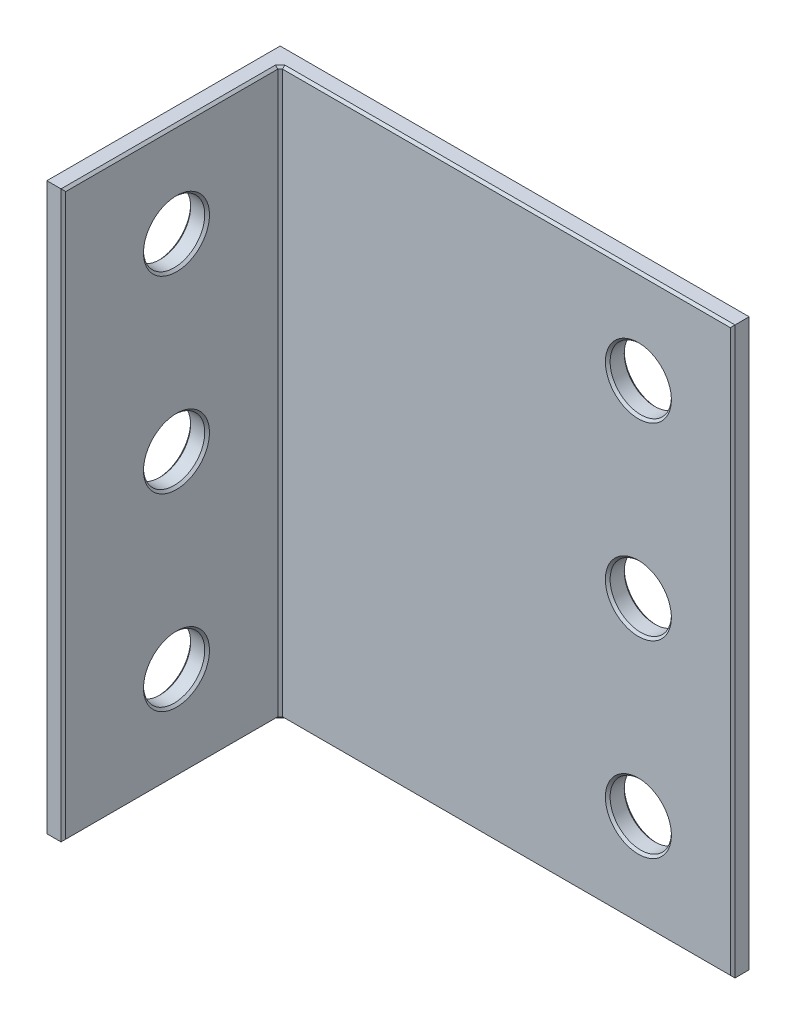
from build123d import *

# Parameters (mm, degrees)
SKETCH_1_W          = 200
SKETCH_1_H          = 240
SKETCH_1_R          = 13
EXTRUDE_323_DEPTH   = 8
SKETCH_2_W          = 8
SKETCH_2_H          = 240
EXTRUDE_1_DEPTH     = 92
SKETCH_3_R          = 13
CUT_EXTRUDE_1_DEPTH = 329.024389337
CHAMFER_1_SIZE      = 1


with BuildPart() as part:
    # 草图1 → Extrude 323 (new body)
    with BuildSketch(Plane.XY):
        with Locations((100, 120)):
            Rectangle(SKETCH_1_W, SKETCH_1_H)
        with Locations((160, 40)):
            Circle(SKETCH_1_R, mode=Mode.SUBTRACT)
        with Locations((160, 120)):
            Circle(SKETCH_1_R, mode=Mode.SUBTRACT)
        with Locations((160, 200)):
            Circle(SKETCH_1_R, mode=Mode.SUBTRACT)
    extrude(amount=EXTRUDE_323_DEPTH)

    # 草图2 → 凸台-拉伸1 (add)
    with BuildSketch(Plane.XY.offset(8)):
        with Locations((4, 120)):
            Rectangle(SKETCH_2_W, SKETCH_2_H)
    extrude(amount=EXTRUDE_1_DEPTH)

    # 草图3 → 切除-拉伸1 (cut, through all)
    with BuildSketch(Plane.ZY):
        with Locations((52, 200)):
            Circle(SKETCH_3_R)
        with Locations((52, 120)):
            Circle(SKETCH_3_R)
        with Locations((52, 40)):
            Circle(SKETCH_3_R)
    extrude(amount=-CUT_EXTRUDE_1_DEPTH, mode=Mode.SUBTRACT)

    # 倒角1
    chamfer_1_edges = [part.edges().sort_by_distance(p)[0] for p in [
        (200, 120, 8),
        (147, 40, 0),
        (147, 40, 8),
        (104, 240, 8),
        (147, 120, 0),
        (147, 120, 8),
        (147, 200, 0),
        (147, 200, 8),
        (104, 0, 8),
        (8, 120, 8),
        (8, 0, 54),
        (8, 240, 54),
        (0, 120, 100),
        (8, 120, 100),
        (8, 200, 39),
        (0, 200, 39),
        (100, 240, 0),
        (8, 120, 39),
        (0, 120, 39),
        (200, 120, 0),
        (8, 40, 39),
        (0, 40, 39),
        (100, 0, 0),
        (0, 120, 0),
        (0, 240, 50),
        (0, 0, 50),
    ]]
    chamfer(chamfer_1_edges, length=CHAMFER_1_SIZE)


solid = part.part
